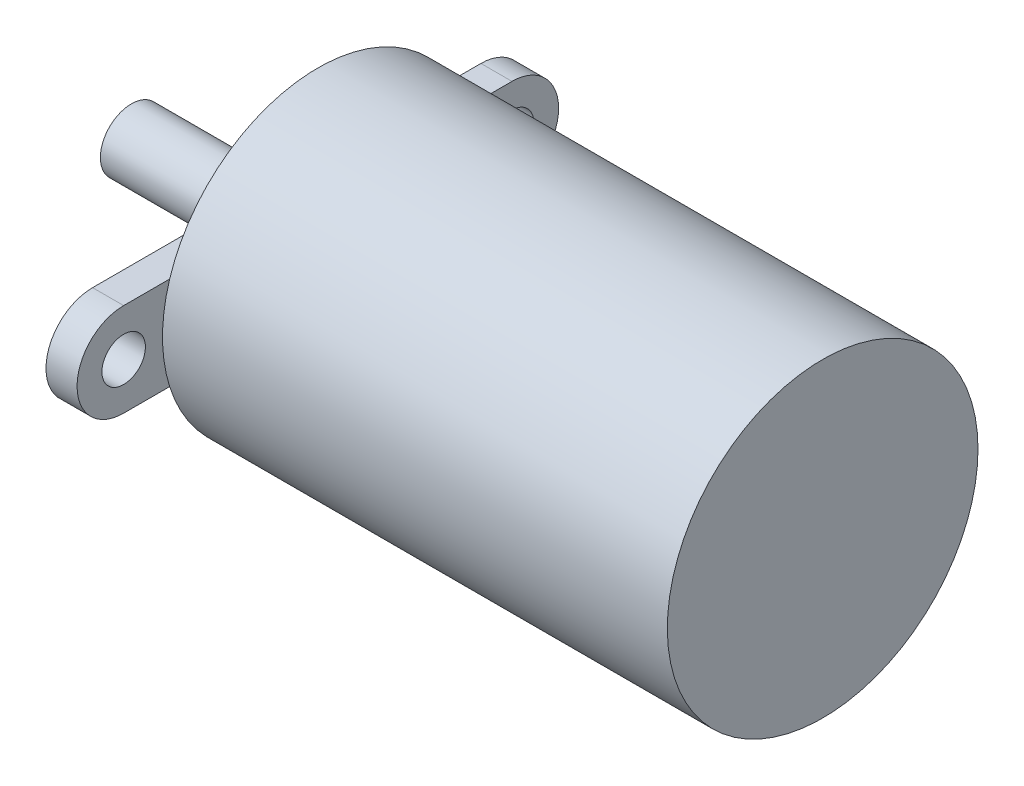
from build123d import *

# Parameters (mm, degrees)
SKETCH1_R                      = 10
BOSS_EXTRUDE1_DEPTH            = 32.5
BOSS_EXTRUDE2_DEPTH            = 2
F_2_8_2_8_DIAMETER_HOLE1_D     = 2.8
F_2_8_2_8_DIAMETER_HOLE1_DEPTH = 70
F_2_8_2_8_DIAMETER_HOLE1_TIP   = 0.841204867
SKETCH5_R                      = 4
BOSS_EXTRUDE3_DEPTH            = 2
SKETCH6_R                      = 2
BOSS_EXTRUDE4_DEPTH            = 8


with BuildPart() as part:
    # Sketch1 → Boss-Extrude1 (new body)
    with BuildSketch(Plane(origin=(0, 0, 0), x_dir=(0, 0, -1), z_dir=(1, 0, 0))):
        Circle(SKETCH1_R)
    extrude(amount=BOSS_EXTRUDE1_DEPTH)

    # Sketch2 → Boss-Extrude2 (add)
    with BuildSketch(Plane.ZY):
        with BuildLine():
            Line((-12.5, 3), (12.5, 3))
            ThreePointArc((12.5, 3), (15.5, 0), (12.5, -3))
            Line((12.5, -3), (-12.5, -3))
            ThreePointArc((-12.5, -3), (-15.5, 0), (-12.5, 3))
        make_face()
    extrude(amount=BOSS_EXTRUDE2_DEPTH)

    # Ø2.8 (2.8) Diameter Hole1
    with Locations(Plane.ZY.offset(2)):
        with Locations((-12.5, 0), (12.5, 0)):
            Hole(F_2_8_2_8_DIAMETER_HOLE1_D / 2, depth=F_2_8_2_8_DIAMETER_HOLE1_DEPTH)
            with Locations((0, 0, -(F_2_8_2_8_DIAMETER_HOLE1_DEPTH + F_2_8_2_8_DIAMETER_HOLE1_TIP / 2))):  # 118° drill point
                Cone(0, F_2_8_2_8_DIAMETER_HOLE1_D / 2, F_2_8_2_8_DIAMETER_HOLE1_TIP, mode=Mode.SUBTRACT)

    # Sketch5 → Boss-Extrude3 (add)
    with BuildSketch(Plane.ZY.offset(2)):
        with Locations(Location((0, 0, 0), (0, 0, 228.590377891))):
            Circle(SKETCH5_R)
    extrude(amount=BOSS_EXTRUDE3_DEPTH)

    # Sketch6 → Boss-Extrude4 (add)
    with BuildSketch(Plane.ZY.offset(4)):
        Circle(SKETCH6_R)
    extrude(amount=BOSS_EXTRUDE4_DEPTH)


solid = part.part
